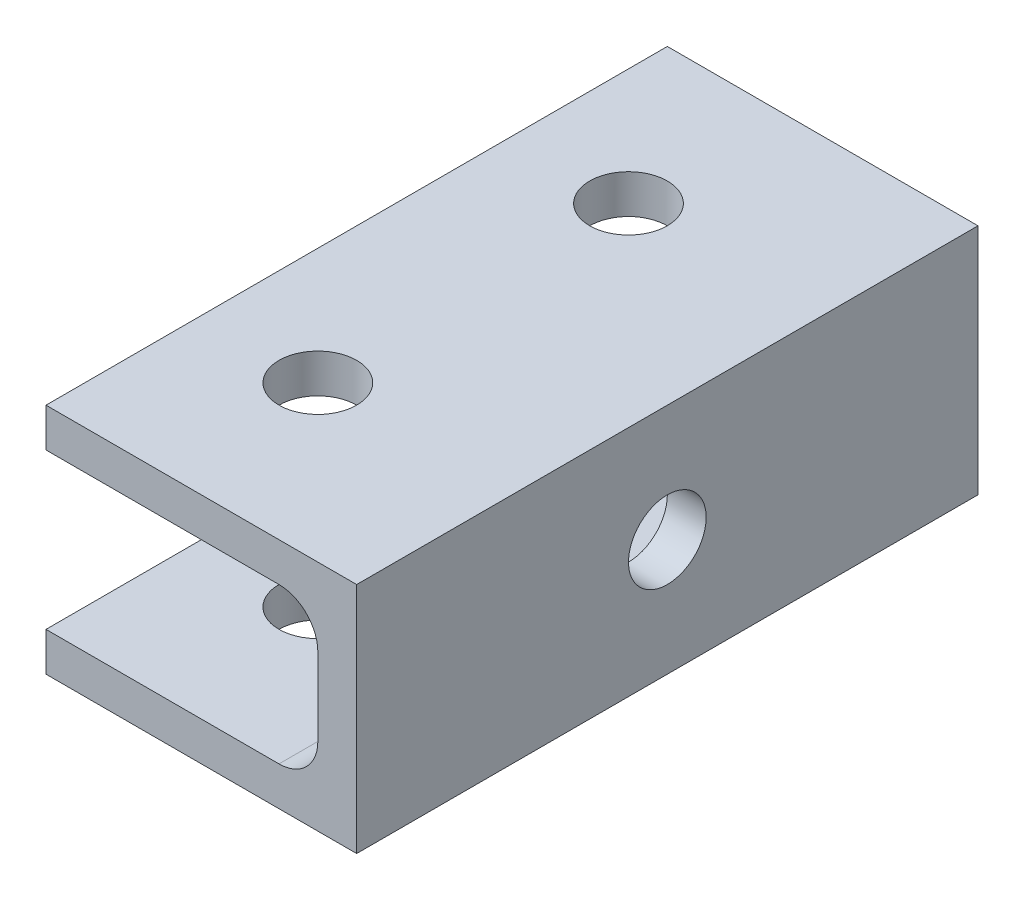
from build123d import *

# Parameters (mm, degrees)
BOSS_EXTRUDE1_DEPTH = 80
FILLET1_R           = 5
SKETCH2_R           = 5
CUT_EXTRUDE1_DEPTH  = 75
SKETCH3_R           = 5
CUT_EXTRUDE2_DEPTH  = 10


with BuildPart() as part:
    # Sketch1 → Boss-Extrude1 (new body)
    with BuildSketch(Plane.XY):
        Polygon((0, 0), (35, 0), (35, -20), (0, -20), (0, -25), (40, -25), (40, 5), (0, 5), align=None)
    extrude(amount=BOSS_EXTRUDE1_DEPTH)

    # Fillet1
    fillet1_edges = [part.edges().sort_by_distance(p)[0] for p in [
        (35, -20, 40),
        (35, 0, 40),
    ]]
    fillet(fillet1_edges, radius=FILLET1_R)

    # Sketch2 → Cut-Extrude1 (cut)
    with BuildSketch(Plane(origin=(0, 5, 0), x_dir=(1, 0, 0), z_dir=(0, 1, 0))):
        with Locations(Location((15, -60, 0), (0, 0, 180))):
            Circle(SKETCH2_R)
        with Locations(Location((15, -20, 0), (0, 0, 270))):
            Circle(SKETCH2_R)
    extrude(amount=-CUT_EXTRUDE1_DEPTH, mode=Mode.SUBTRACT)

    # Sketch3 → Cut-Extrude2 (cut)
    with BuildSketch(Plane(origin=(40, 0, 0), x_dir=(0, 0, -1), z_dir=(1, 0, 0))):
        with Locations((-40, -10)):
            Circle(SKETCH3_R)
    extrude(amount=-CUT_EXTRUDE2_DEPTH, mode=Mode.SUBTRACT)


solid = part.part
